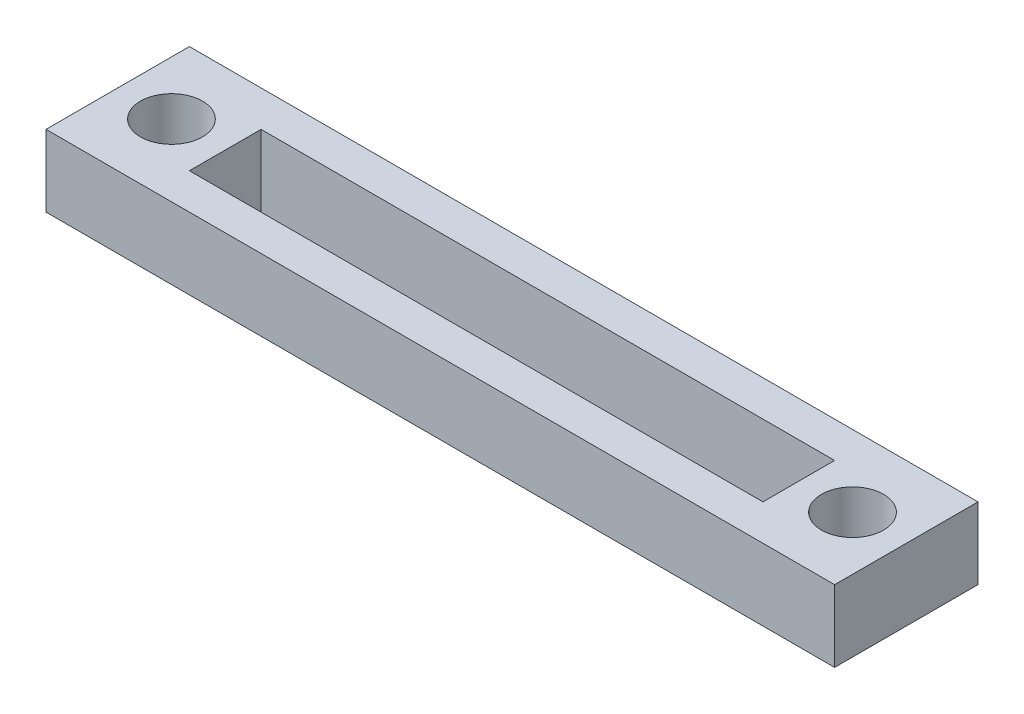
from build123d import *

# Parameters (mm, degrees)
SKETCH1_W            = 69.85
SKETCH1_H            = 12.7
SKETCH1_W_2          = 50.8
SKETCH1_H_2          = 6.35
BOSS_EXTRUDE1_DEPTH  = 6.35
M5_CLEARANCE_HOLE1_D = 5.5


with BuildPart() as part:
    # Sketch1 → Boss-Extrude1 (new body)
    with BuildSketch(Plane(origin=(0, 0, 0), x_dir=(1, 0, 0), z_dir=(0, 1, 0))):
        Rectangle(SKETCH1_W, SKETCH1_H)
        Rectangle(SKETCH1_W_2, SKETCH1_H_2, mode=Mode.SUBTRACT)
    extrude(amount=BOSS_EXTRUDE1_DEPTH)

    # M5 Clearance Hole1 (through all)
    with Locations(Plane(origin=(0, 6.35, 0), x_dir=(1, 0, 0), z_dir=(0, 1, 0))):
        with Locations((-30.1625, 0)):
            m5_clearance_hole1 = Hole(M5_CLEARANCE_HOLE1_D / 2)

    # Mirror1: M5 Clearance Hole1 across plane
    add(m5_clearance_hole1.mirror(Plane(origin=(0, 0, 0), x_dir=(0, 0, 1), z_dir=(1, 0, 0))), mode=Mode.SUBTRACT)


solid = part.part
